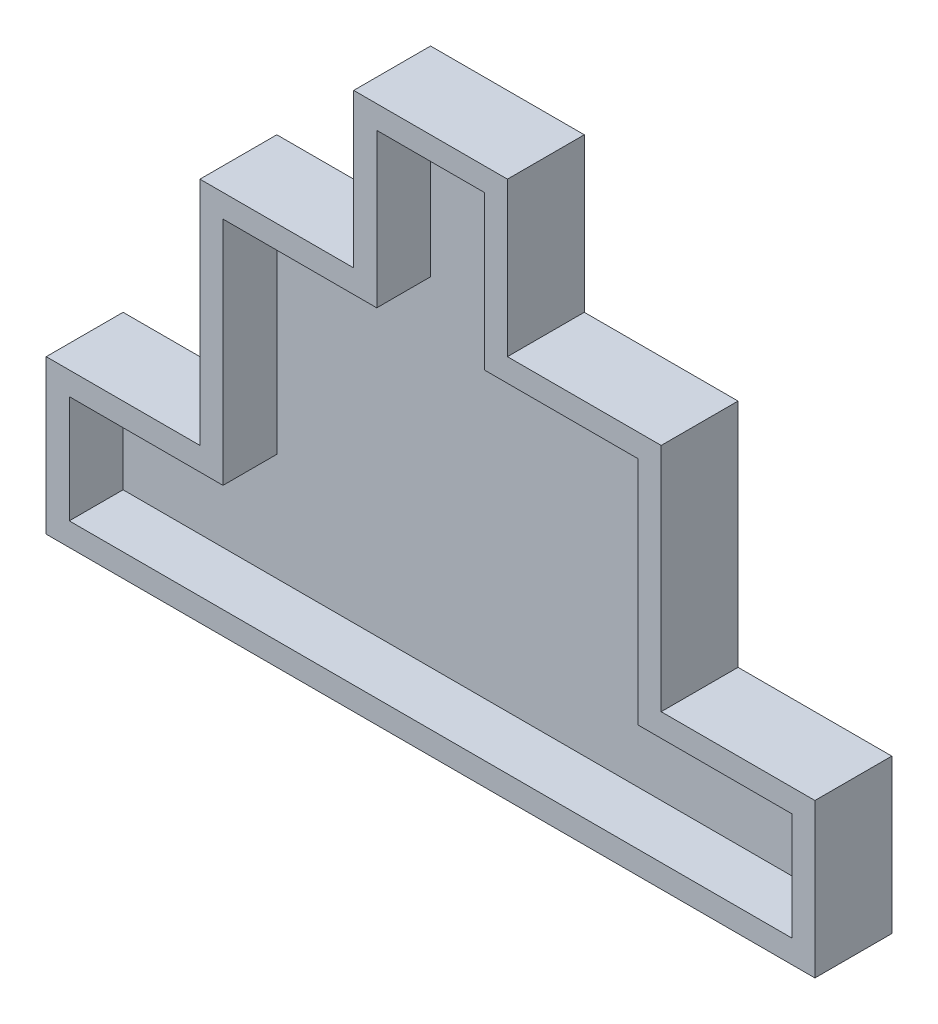
from build123d import *

# Parameters (mm, degrees)
BOSS_EXTRUDE1_DEPTH = 15
BOSS_EXTRUDE2_DEPTH = 4.5


with BuildPart() as part:
    # Sketch1 → Boss-Extrude1 (new body)
    with BuildSketch(Plane.XY):
        Polygon((75, 0), (-75, 0), (-75, 30), (-45, 30), (-45, 75), (-15, 75), (-15, 105), (15, 105), (15, 75), (45, 75), (45, 30), (75, 30), align=None)
        Polygon((-70.5, 4.5), (-70.5, 25.5), (-40.5, 25.5), (-40.5, 70.5), (-10.5, 70.5), (-10.5, 100.5), (10.5, 100.5), (10.5, 70.5), (40.5, 70.5), (40.5, 25.5), (70.5, 25.5), (70.5, 4.5), align=None, mode=Mode.SUBTRACT)
    extrude(amount=BOSS_EXTRUDE1_DEPTH)

    # Sketch1<2> → Boss-Extrude2 (add)
    with BuildSketch(Plane.XY):
        Polygon((-70.5, 4.5), (-70.5, 25.5), (-40.5, 25.5), (-40.5, 70.5), (-10.5, 70.5), (-10.5, 100.5), (10.5, 100.5), (10.5, 70.5), (40.5, 70.5), (40.5, 25.5), (70.5, 25.5), (70.5, 4.5), align=None)
    extrude(amount=BOSS_EXTRUDE2_DEPTH)


solid = part.part
